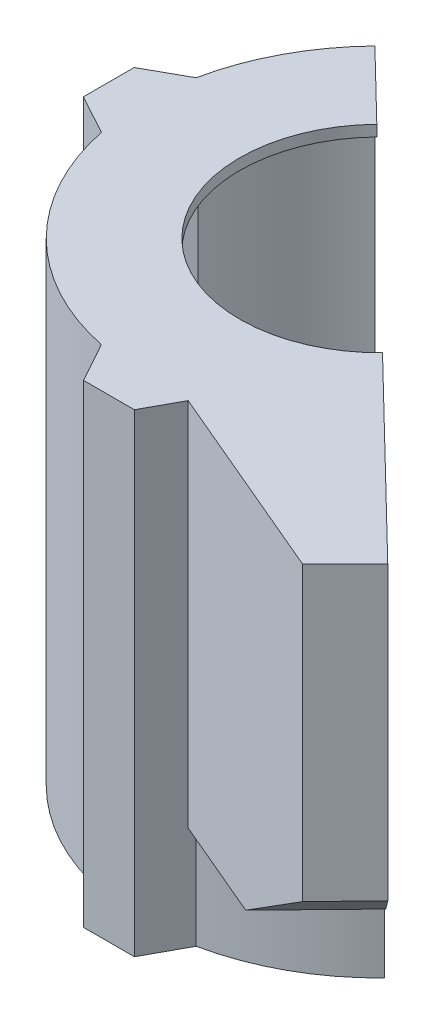
from build123d import *
from build123d.topology import SkipClean

# Parameters (mm, degrees)
SALIENTE_EXTRUIR1_DEPTH  = 5
CROQUIS2_R               = 2.1
CORTAR_EXTRUIR1_DEPTH    = 83.176639016
CORTAR_EXTRUIR2_DEPTH    = 83.176639016
CROQUIS5_R               = 2.05
CORTAR_EXTRUIR4_DEPTH    = 83.176639016
SALIENTE_EXTRUIR2_DEPTH  = 5
CORTAR_EXTRUIR10_DEPTH   = 98.128780493
SALIENTE_EXTRUIR4_DEPTH  = 4
SALIENTE_EXTRUIR5_DEPTH  = 4
CROQUIS17_R              = 2.4
CORTAR_EXTRUIR11_DEPTH   = 98.128780493
SALIENTE_EXTRUIR6_DEPTH  = 105
CORTAR_EXTRUIR12_DEPTH   = 200
CORTAR_EXTRUIR13_DEPTH   = 200
SALIENTE_EXTRUIR7_DEPTH  = 93.5
CROQUIS28_W              = 67.409090619
CROQUIS28_H              = 26
CORTAR_EXTRUIR15_DEPTH   = 104
SALIENTE_EXTRUIR12_START = 2.5
SALIENTE_EXTRUIR12_DEPTH = 2.5
SALIENTE_EXTRUIR13_START = 23.5
SALIENTE_EXTRUIR13_DEPTH = 23.5
CORTAR_EXTRUIR20_DEPTH   = 50
SALIENTE_EXTRUIR18_DEPTH = 30.5
CROQUIS45_W              = 45.132524043
CROQUIS45_H              = 53.175944169
CORTAR_EXTRUIR23_DEPTH   = 30.5
CROQUIS46_W              = 25.804527637
CROQUIS46_H              = 25.652736297
CORTAR_EXTRUIR24_DEPTH   = 30.5
CORTAR_EXTRUIR26_DEPTH   = 59
SALIENTE_EXTRUIR19_DEPTH = 2.5
CROQUIS49_W              = 1.3
CROQUIS49_H              = 62.443972795
CORTAR_EXTRUIR27_DEPTH   = 2.5
CROQUIS50_W              = 40
CROQUIS50_H              = 1.3
CORTAR_EXTRUIR28_DEPTH   = 2.5
CROQUIS51_W              = 13
CROQUIS51_H              = 1.3
CORTAR_EXTRUIR29_DEPTH   = 2.5


with BuildPart() as part:
    # Croquis1 → Saliente-Extruir1 (new body)
    with BuildSketch(Plane(origin=(0, 0, 0), x_dir=(1, 0, 0), z_dir=(0, 1, 0))):
        with BuildLine():
            Line((4, 58), (8.807070745, 49.218243619))
            ThreePointArc((8.807070745, 49.218243619), (35.355339059, 35.355339059), (49.218243619, 8.807070745))
            Line((49.218243619, 8.807070745), (58, 4))
            Line((58, 4), (58, -4))
            Line((58, -4), (49.218243619, -8.807070745))
            ThreePointArc((49.218243619, -8.807070745), (35.355339059, -35.355339059), (8.807070745, -49.218243619))
            Line((8.807070745, -49.218243619), (4, -58))
            Line((4, -58), (-4, -58))
            Line((-4, -58), (-8.807070745, -49.218243619))
            ThreePointArc((-8.807070745, -49.218243619), (-35.355339059, -35.355339059), (-49.218243619, -8.807070745))
            Line((-49.218243619, -8.807070745), (-58, -4))
            Line((-58, -4), (-58, 4))
            Line((-58, 4), (-49.218243619, 8.807070745))
            ThreePointArc((-49.218243619, 8.807070745), (-35.355339059, 35.355339059), (-8.807070745, 49.218243619))
            Line((-8.807070745, 49.218243619), (-4, 58))
            Line((-4, 58), (4, 58))
        make_face()
    extrude(amount=SALIENTE_EXTRUIR1_DEPTH)

    # Croquis2 → Cortar-Extruir1 (cut, through all)
    with BuildSketch(Plane(origin=(0, 5, 0), x_dir=(1, 0, 0), z_dir=(0, 1, 0))):
        with Locations(Location((0, 52.7, 0), (0, 0, 270))):
            Circle(CROQUIS2_R)
        with Locations(Location((52.7, 0, 0), (0, 0, 270))):
            Circle(CROQUIS2_R)
        with Locations(Location((0, -52.7, 0), (0, 0, 270))):
            Circle(CROQUIS2_R)
        with Locations(Location((-52.7, 0, 0), (0, 0, 270))):
            Circle(CROQUIS2_R)
    extrude(amount=-CORTAR_EXTRUIR1_DEPTH, mode=Mode.SUBTRACT)

    # Croquis3 → Cortar-Extruir2 (cut, through all)
    with BuildSketch(Plane(origin=(0, 5, 0), x_dir=(1, 0, 0), z_dir=(0, 1, 0))):
        Polygon((20.506096654, -34.648232278), (34.648232278, -20.506096654), (47.376154339, -33.234018716), (67.218949341, -53.076813717), (53.076813717, -67.218949341), (33.234018716, -47.376154339), align=None)
    extrude(amount=-CORTAR_EXTRUIR2_DEPTH, mode=Mode.SUBTRACT)

    # Croquis5 → Cortar-Extruir4 (cut, through all)
    with BuildSketch(Plane(origin=(0, 5, 0), x_dir=(1, 0, 0), z_dir=(0, 1, 0))):
        with Locations(Location((-7.78, 7.78, 0), (0, 0, 270))):
            Circle(CROQUIS5_R)
        with Locations(Location((7.78, 7.78, 0), (0, 0, 270))):
            Circle(CROQUIS5_R)
        with Locations(Location((7.78, -7.78, 0), (0, 0, 270))):
            Circle(CROQUIS5_R)
        with Locations(Location((-7.78, -7.78, 0), (0, 0, 270))):
            Circle(CROQUIS5_R)
        with BuildLine():
            Line((21.554064831, -30.039346205), (23.334523779, -31.819805153))
            Line((23.334523779, -31.819805153), (24.748737342, -30.405591591))
            Line((24.748737342, -30.405591591), (22.968278393, -28.625132642))
            ThreePointArc((22.968278393, -28.625132642), (19.622213178, -26.69328099), (21.554064831, -30.039346205))
        make_face()
        with BuildLine():
            Line((28.625132642, -22.968278393), (30.986174209, -25.329319959))
            Line((30.986174209, -25.329319959), (32.400387771, -23.915106397))
            Line((32.400387771, -23.915106397), (30.039346205, -21.554064831))
            ThreePointArc((30.039346205, -21.554064831), (26.69328099, -19.622213178), (28.625132642, -22.968278393))
        make_face()
    extrude(amount=-CORTAR_EXTRUIR4_DEPTH, mode=Mode.SUBTRACT)

    # Croquis7 → Saliente-Extruir2 (add, through all)
    with BuildSketch(Plane(origin=(0, 5, 0), x_dir=(1, 0, 0), z_dir=(0, 1, 0))):
        Polygon((68.589357775, -54.447222151), (54.447222151, -68.589357775), (8.807070745, -49.218243619), (18.571685103, -46.422973972), (27.56994834, -41.712083963), (48.790367902, -62.932503526), (62.932503526, -48.790367902), (41.712083963, -27.56994834), (46.422973972, -18.571685103), (49.218243619, -8.807070745), align=None)
    extrude(amount=-SALIENTE_EXTRUIR2_DEPTH)

    # Croquis8 → Cortar-Extruir10 (cut, through all)
    with BuildSketch(Plane(origin=(0, 5, 0), x_dir=(1, 0, 0), z_dir=(0, 1, 0))):
        with BuildLine():
            Line((54.283137452, -59.939991701), (51.490214314, -57.147068564))
            Line((51.490214314, -57.147068564), (50.076000752, -58.561282126))
            Line((50.076000752, -58.561282126), (52.868923889, -61.354205264))
            ThreePointArc((52.868923889, -61.354205264), (56.214989104, -63.286056916), (54.283137452, -59.939991701))
        make_face()
        with BuildLine():
            Line((57.371843354, -51.714989104), (58.786056916, -50.300775542))
            Line((58.786056916, -50.300775542), (61.354205264, -52.868923889))
            ThreePointArc((61.354205264, -52.868923889), (63.286056916, -56.214989104), (59.939991701, -54.283137452))
            Line((59.939991701, -54.283137452), (57.371843354, -51.714989104))
        make_face()
    extrude(amount=-CORTAR_EXTRUIR10_DEPTH, mode=Mode.SUBTRACT)

    # Croquis15 → Saliente-Extruir4 (add)
    with BuildSketch(Plane.XZ):
        with BuildLine():
            Line((-1.111111111, -20.469866441), (-1.111111111, -22.472548411))
            ThreePointArc((-1.111111111, -22.472548411), (0, 22.5), (1.111111111, -22.472548411))
            Line((1.111111111, -22.472548411), (1.111111111, -20.469866441))
            ThreePointArc((1.111111111, -20.469866441), (0, 20.5), (-1.111111111, -20.469866441))
        make_face()
    extrude(amount=SALIENTE_EXTRUIR4_DEPTH)

    # Croquis16 → Saliente-Extruir5 (add)
    with SkipClean():  # the faces are left unmerged after this step: merging them gives an invalid solid
        with BuildSketch(Plane.XZ):
            with BuildLine():
                Line((-1.111111111, -20.469866441), (-1.111111111, -22.472548411))
                ThreePointArc((-1.111111111, -22.472548411), (0, -22.5), (1.111111111, -22.472548411))
                Line((1.111111111, -22.472548411), (1.111111111, -20.469866441))
                ThreePointArc((1.111111111, -20.469866441), (0, -20.5), (-1.111111111, -20.469866441))
            make_face()
        extrude(amount=SALIENTE_EXTRUIR5_DEPTH)

    # Croquis17 → Cortar-Extruir11 (cut, through all)
    with SkipClean():  # the faces are left unmerged after this step: merging them gives an invalid solid
        with BuildSketch(Plane.XZ):
            with Locations(Location((42.43, 0, 0), (0, 0, 270))):
                Circle(CROQUIS17_R)
            with Locations(Location((0, -42.43, 0), (0, 0, 270))):
                Circle(CROQUIS17_R)
            with Locations(Location((-42.43, 0, 0), (0, 0, 270))):
                Circle(CROQUIS17_R)
            with Locations(Location((0, 42.43, 0), (0, 0, 270))):
                Circle(CROQUIS17_R)
        extrude(amount=-CORTAR_EXTRUIR11_DEPTH, mode=Mode.SUBTRACT)

    # Croquis18 → Saliente-Extruir6 (add)
    with SkipClean():  # the faces are left unmerged after this step: merging them gives an invalid solid
        with BuildSketch(Plane(origin=(0, 5, 0), x_dir=(1, 0, 0), z_dir=(0, 1, 0))):
            with BuildLine():
                Line((-7.026199157, 59.180786921), (-10.712769702, 52.416472271))
                ThreePointArc((-10.712769702, 52.416472271), (-37.80704006, 37.853371341), (-52.403312858, 10.776956969))
                Line((-52.403312858, 10.776956969), (-59.137075713, 7.002717611))
                Line((-59.137075713, 7.002717611), (-61.456288791, 5.738739948))
                Line((-61.456288791, 5.738739948), (-61.456288791, -5.78570304))
                Line((-61.456288791, -5.78570304), (-59.137075713, -7.049680703))
                Line((-59.137075713, -7.049680703), (-52.416550741, -10.71238575))
                ThreePointArc((-52.416550741, -10.71238575), (-37.841055246, -37.819367233), (-10.74243433, -52.41040073))
                Line((-10.74243433, -52.41040073), (-6.959006403, -59.160557259))
                Line((-6.959006403, -59.160557259), (-5.695028739, -61.479770337))
                Line((-5.695028739, -61.479770337), (5.829414249, -61.479770337))
                Line((5.829414249, -61.479770337), (7.093391912, -59.160557259))
                Line((7.093391912, -59.160557259), (10.133049539, -53.583232651))
                Line((10.133049539, -53.583232651), (55.252838681, -72.733488714))
                Line((55.252838681, -72.733488714), (72.733488714, -55.252838681))
                Line((72.733488714, -55.252838681), (53.583232651, -10.133049539))
                Line((53.583232651, -10.133049539), (59.204268467, -6.982487949))
                Line((59.204268467, -6.982487949), (61.523481546, -5.718510285))
                Line((61.523481546, -5.718510285), (61.523481546, 5.805932703))
                Line((61.523481546, 5.805932703), (59.204268467, 7.069910366))
                Line((59.204268467, 7.069910366), (52.403430197, 10.776386386))
                ThreePointArc((52.403430197, 10.776386386), (37.849997802, 37.810417433), (10.831208274, 52.392126578))
                Line((10.831208274, 52.392126578), (7.026199157, 59.180786921))
                Line((7.026199157, 59.180786921), (5.762221494, 61.5))
                Line((5.762221494, 61.5), (-5.762221494, 61.5))
                Line((-5.762221494, 61.5), (-7.026199157, 59.180786921))
            make_face()
        extrude(amount=SALIENTE_EXTRUIR6_DEPTH)

    # Croquis23 → Cortar-Extruir12 (cut)
    with BuildSketch(Plane.XZ.offset(4)):
        with BuildLine():
            Line((59, -4.59262422), (58.95889986, -4.615122143))
            Line((58.95889986, -4.615122143), (50.492416575, -9.249614646))
            ThreePointArc((50.492416575, -9.249614646), (36.297654901, -36.297654901), (9.249614646, -50.492416575))
            Line((9.249614646, -50.492416575), (4.615122143, -58.95889986))
            Line((4.615122143, -58.95889986), (4.592624221, -59))
            Line((4.592624221, -59), (-4.59262422, -59))
            Line((-4.59262422, -59), (-4.615122143, -58.95889986))
            Line((-4.615122143, -58.95889986), (-9.249614646, -50.492416575))
            ThreePointArc((-9.249614646, -50.492416575), (-36.297654901, -36.297654901), (-50.492416575, -9.249614646))
            Line((-50.492416575, -9.249614646), (-58.95889986, -4.615122143))
            Line((-58.95889986, -4.615122143), (-59, -4.592624221))
            Line((-59, -4.592624221), (-59, 4.59262422))
            Line((-59, 4.59262422), (-58.95889986, 4.615122143))
            Line((-58.95889986, 4.615122143), (-50.492416575, 9.249614646))
            ThreePointArc((-50.492416575, 9.249614646), (-36.297654901, 36.297654901), (-9.249614646, 50.492416575))
            Line((-9.249614646, 50.492416575), (-4.615122143, 58.95889986))
            Line((-4.615122143, 58.95889986), (-4.592624221, 59))
            Line((-4.592624221, 59), (4.59262422, 59))
            Line((4.59262422, 59), (4.615122143, 58.95889986))
            Line((4.615122143, 58.95889986), (9.249614646, 50.492416575))
            Line((9.249614646, 50.492416575), (54.677398303, 69.773395186))
            Line((54.677398303, 69.773395186), (69.773395186, 54.677398303))
            Line((69.773395186, 54.677398303), (50.492416575, 9.249614646))
            Line((50.492416575, 9.249614646), (58.95889986, 4.615122143))
            Line((58.95889986, 4.615122143), (59, 4.592624221))
            Line((59, 4.592624221), (59, -4.59262422))
        make_face()
    extrude(amount=-CORTAR_EXTRUIR12_DEPTH, mode=Mode.SUBTRACT)

    # Croquis24 → Cortar-Extruir13 (cut)
    with BuildSketch(Plane.XZ.offset(-5)):
        Polygon((70.463480146, 68.467722749), (119.078352052, 18.435781803), (-1.311453111, -98.544188314), (-49.926325017, -48.512247367), align=None)
    extrude(amount=-CORTAR_EXTRUIR13_DEPTH, mode=Mode.SUBTRACT)

    # Croquis27 → Saliente-Extruir7 (add)
    with BuildSketch(Plane(origin=(0, 110, 0), x_dir=(1, 0, 0), z_dir=(0, 1, 0))):
        with BuildLine():
            Line((-52.7, 3.8), (-55.85, 3.8))
            Line((-55.85, 3.8), (-57.285166424, 5.531311876))
            Line((-57.285166424, 5.531311876), (-59, 4.59262422))
            Line((-59, 4.59262422), (-59, 4.1))
            Line((-59, 4.1), (-59, -4.1))
            Line((-59, -4.1), (-59, -4.59262422))
            Line((-59, -4.59262422), (-57.285166424, -5.531311876))
            Line((-57.285166424, -5.531311876), (-55.85, -3.8))
            Line((-55.85, -3.8), (-52.7, -3.8))
            ThreePointArc((-52.7, -3.8), (-51.320540321, -3.540775479), (-50.129285786, -2.798468944))
            ThreePointArc((-50.129285786, -2.798468944), (-49.863593997, -2.049234472), (-50.129285786, -1.3))
            Line((-50.129285786, -1.3), (-50.172155068, -1.3))
            ThreePointArc((-50.172155068, -1.3), (-50.775893422, -1.404270069), (-51.309685287, -1.705))
            ThreePointArc((-51.309685287, -1.705), (-54.9, 0), (-51.309685287, 1.705))
            ThreePointArc((-51.309685287, 1.705), (-50.775893422, 1.404270069), (-50.172155068, 1.3))
            Line((-50.172155068, 1.3), (-50.129285786, 1.3))
            ThreePointArc((-50.129285786, 1.3), (-49.863593997, 2.049234472), (-50.129285786, 2.798468944))
            ThreePointArc((-50.129285786, 2.798468944), (-51.320540321, 3.540775479), (-52.7, 3.8))
        make_face()
        with BuildLine():
            Line((-3.8, -52.7), (-3.8, -55.85))
            Line((-3.8, -55.85), (-5.531311876, -57.285166424))
            Line((-5.531311876, -57.285166424), (-4.59262422, -59))
            Line((-4.59262422, -59), (-4.1, -59))
            Line((-4.1, -59), (4.1, -59))
            Line((4.1, -59), (4.59262422, -59))
            Line((4.59262422, -59), (5.531311876, -57.285166424))
            Line((5.531311876, -57.285166424), (3.8, -55.85))
            Line((3.8, -55.85), (3.8, -52.7))
            ThreePointArc((3.8, -52.7), (3.540775479, -51.320540321), (2.798468944, -50.129285786))
            ThreePointArc((2.798468944, -50.129285786), (2.049234472, -49.863593997), (1.3, -50.129285786))
            Line((1.3, -50.129285786), (1.3, -50.172155068))
            ThreePointArc((1.3, -50.172155068), (1.404270069, -50.775893422), (1.705, -51.309685287))
            ThreePointArc((1.705, -51.309685287), (0, -54.9), (-1.705, -51.309685287))
            ThreePointArc((-1.705, -51.309685287), (-1.404270069, -50.775893422), (-1.3, -50.172155068))
            Line((-1.3, -50.172155068), (-1.3, -50.129285786))
            ThreePointArc((-1.3, -50.129285786), (-2.049234472, -49.863593997), (-2.798468944, -50.129285786))
            ThreePointArc((-2.798468944, -50.129285786), (-3.540775479, -51.320540321), (-3.8, -52.7))
        make_face()
    extrude(amount=-SALIENTE_EXTRUIR7_DEPTH)

    # Croquis28 → Cortar-Extruir15 (cut)
    with BuildSketch(Plane(origin=(30.327841924, 0, 16.528759307), x_dir=(0.4785464071110931, 0, -0.8780622621665641), z_dir=(0.878062262166564, 0, 0.47854640711109303))):
        with Locations((-17.488875667, 18)):
            Rectangle(CROQUIS28_W, CROQUIS28_H)
    extrude(amount=CORTAR_EXTRUIR15_DEPTH, mode=Mode.SUBTRACT)

    # Croquis35 → Saliente-Extruir12 (add)
    with BuildSketch(Plane.XZ.offset(-31).offset(SALIENTE_EXTRUIR12_START)):
        with BuildLine():
            Line((36.815275181, 35.772545563), (64.912430407, 63.073896988))
            Line((64.912430407, 63.073896988), (55.252838681, 72.733488714))
            Line((55.252838681, 72.733488714), (10.133049539, 53.583232651))
            Line((10.133049539, 53.583232651), (9.249614646, 50.492416575))
            ThreePointArc((9.249614646, 50.492416575), (24.179788447, 45.281092448), (36.815275181, 35.772545563))
        make_face()
    extrude(amount=-SALIENTE_EXTRUIR12_DEPTH)

    # Croquis36 → Saliente-Extruir13 (add)
    with BuildSketch(Plane.XZ.offset(-28.5).offset(SALIENTE_EXTRUIR13_START)):
        with BuildLine():
            Line((36.815275181, 35.772545563), (38.369688012, 37.282932313))
            ThreePointArc((38.369688012, 37.282932313), (24.431166149, 47.595883442), (7.92649179, 52.909552331))
            Line((7.92649179, 52.909552331), (9.249614646, 50.492416575))
            ThreePointArc((9.249614646, 50.492416575), (24.179788447, 45.281092448), (36.815275181, 35.772545563))
        make_face()
    extrude(amount=-SALIENTE_EXTRUIR13_DEPTH)

    # Croquis37 → Cortar-Extruir20 (cut)
    with BuildSketch(Plane(origin=(0, 0, 0), x_dir=(-0.7171904301357217, 0, -0.6968772394918195), z_dir=(0.6968772394918195, 0, -0.7171904301357217))):
        Polygon((-63.5, 28.5), (-90.509337102, 28.5), (-90.509337102, 49.5), align=None)
    extrude(amount=-CORTAR_EXTRUIR20_DEPTH, mode=Mode.SUBTRACT)

    # Croquis44 → Saliente-Extruir18 (add)
    with BuildSketch(Plane(origin=(0, 0, 0), x_dir=(-0.7171904301357217, 0, -0.6968772394918195), z_dir=(0.6968772394918195, 0, -0.7171904301357217))):
        Polygon((-90.509337102, 49.5), (-63.5, 28.5), (-67.572932559, 28.5), (-90.509337102, 46.333258683), align=None)
    extrude(amount=-SALIENTE_EXTRUIR18_DEPTH)

    # Croquis45 → Cortar-Extruir23 (cut)
    with BuildSketch(Plane(origin=(-17.724154207, 0, 41.759760177), x_dir=(0.9205192214063578, 0, 0.39069727798057796), z_dir=(-0.39069727798057796, 0, 0.9205192214063578))):
        with Locations((59.311541546, 41.806873094)):
            Rectangle(CROQUIS45_W, CROQUIS45_H)
    extrude(amount=CORTAR_EXTRUIR23_DEPTH, mode=Mode.SUBTRACT)

    # Croquis46 → Cortar-Extruir24 (cut)
    with BuildSketch(Plane(origin=(63.993163697, 0, 63.993163697), x_dir=(0.7071067811865472, 0, -0.7071067811865479), z_dir=(0.7071067811865479, 0, 0.7071067811865472))):
        with Locations((-5.952208555, 48.347893674)):
            Rectangle(CROQUIS46_W, CROQUIS46_H)
    extrude(amount=CORTAR_EXTRUIR24_DEPTH, mode=Mode.SUBTRACT)

    # Croquis47 → Cortar-Extruir26 (cut)
    with BuildSketch(Plane(origin=(0, 110, 0), x_dir=(1, 0, 0), z_dir=(0, 1, 0))):
        Polygon((-57.285166424, -5.531311876), (-58.957315638, -4.617048657), (-58.957315638, -0.023481546), (-59.010484015, 4.569777856), (-57.34902898, 5.503334171), (-47.331961612, 5.503334171), (-47.331961612, -5.531311876), align=None)
        Polygon((5.530814642, -57.284806127), (4.616551423, -58.956955341), (0.022984312, -58.956955341), (-4.57027509, -59.010123718), (-5.503831405, -57.348668683), (-5.503831405, -47.331601315), (5.530814642, -47.331601315), align=None)
    extrude(amount=-CORTAR_EXTRUIR26_DEPTH, mode=Mode.SUBTRACT)

    # Croquis48 → Saliente-Extruir19 (add)
    with BuildSketch(Plane(origin=(0, 110, 0), x_dir=(1, 0, 0), z_dir=(0, 1, 0))):
        with BuildLine():
            Line((-52.403312858, 10.776956969), (-61.456288791, 5.738739948))
            Line((-61.456288791, 5.738739948), (-61.456288791, -5.78570304))
            Line((-61.456288791, -5.78570304), (-52.416550741, -10.71238575))
            ThreePointArc((-52.416550741, -10.71238575), (-37.841055246, -37.819367233), (-10.74243433, -52.41040073))
            Line((-10.74243433, -52.41040073), (-5.695028739, -61.479770337))
            Line((-5.695028739, -61.479770337), (5.829414249, -61.479770337))
            Line((5.829414249, -61.479770337), (10.133049539, -53.583232651))
            Line((10.133049539, -53.583232651), (55.252838681, -72.733488714))
            Line((55.252838681, -72.733488714), (64.912430407, -63.073896988))
            Line((64.912430407, -63.073896988), (22.770796157, -22.125852354))
            ThreePointArc((22.770796157, -22.125852354), (-22.125852354, -22.770796157), (-22.770796157, 22.125852354))
            Line((-22.770796157, 22.125852354), (-38.369688012, 37.282932313))
            ThreePointArc((-38.369688012, 37.282932313), (-47.281879235, 25.033455535), (-52.403312858, 10.776956969))
        make_face()
    extrude(amount=SALIENTE_EXTRUIR19_DEPTH)

    # Croquis49 → Cortar-Extruir27 (cut)
    with BuildSketch(Plane(origin=(0, 0, 0), x_dir=(-0.7171904301357217, 0, -0.6968772394918195), z_dir=(0.6968772394918195, 0, -0.7171904301357217))):
        with Locations((-88.659079171, 78.778013602)):
            Rectangle(CROQUIS49_W, CROQUIS49_H)
    extrude(amount=-CORTAR_EXTRUIR27_DEPTH, mode=Mode.SUBTRACT)

    # Croquis50 → Cortar-Extruir28 (cut)
    with BuildSketch(Plane(origin=(0, 0, 0), x_dir=(-0.7171904301357217, 0, -0.6968772394918195), z_dir=(0.6968772394918195, 0, -0.7171904301357217))):
        with Locations((-61.009079171, 110.65)):
            Rectangle(CROQUIS50_W, CROQUIS50_H)
    extrude(amount=-CORTAR_EXTRUIR28_DEPTH, mode=Mode.SUBTRACT)

    # Croquis51 → Cortar-Extruir29 (cut)
    with BuildSketch(Plane(origin=(0, 0, 0), x_dir=(-0.7171904301357217, 0, -0.6968772394918195), z_dir=(0.6968772394918195, 0, -0.7171904301357217))):
        with Locations((42.25, 110.65)):
            Rectangle(CROQUIS51_W, CROQUIS51_H)
    extrude(amount=-CORTAR_EXTRUIR29_DEPTH, mode=Mode.SUBTRACT)


solid = part.part
